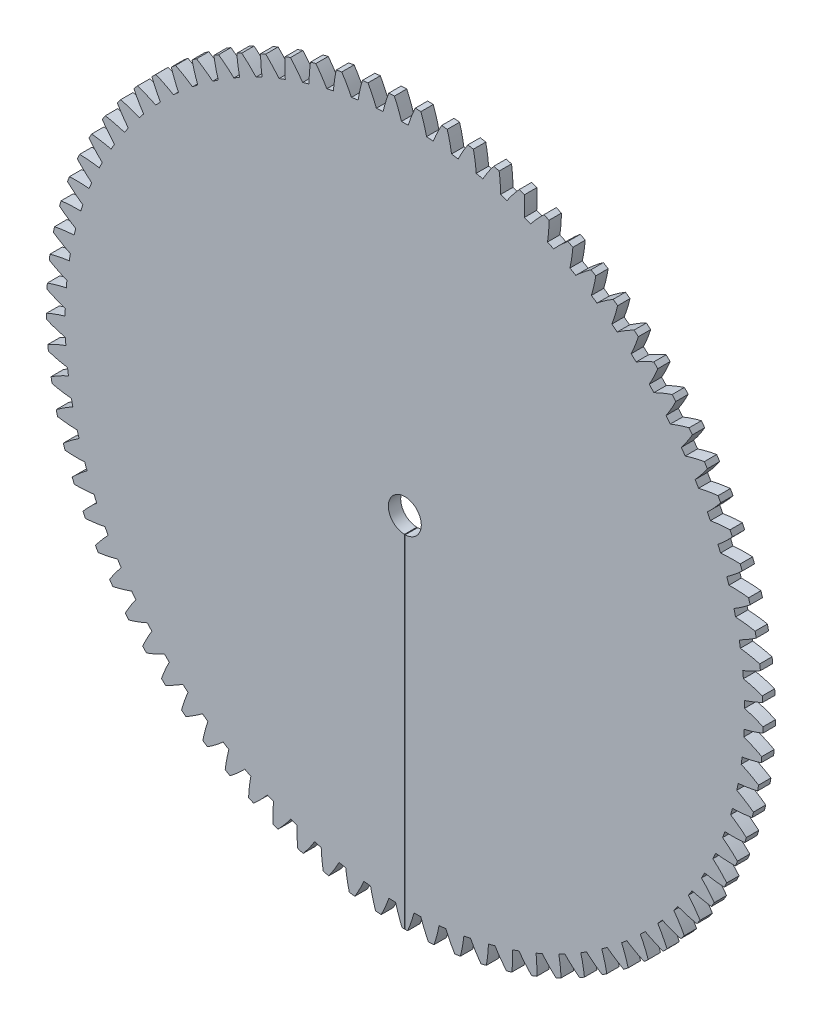
from build123d import *

# Parameters (mm, degrees)
RESSALTO_EXTRUS_O1_DEPTH = 3
CORTE_EXTRUS_O1_DEPTH    = 124.073148981
PADR_OCIRCULAR1_COUNT    = 85


with BuildPart() as part:
    # Esboço1 → Ressalto-extrusão1 (new body)
    with BuildSketch(Plane.XY):
        with BuildLine():
            Line((0.1, -3.998749805), (0.1, -86.999942529))
            ThreePointArc((0.1, -86.999942529), (0, 87), (-0.1, -86.999942529))
            Line((-0.1, -86.999942529), (-0.1, -3.998749805))
            ThreePointArc((-0.1, -3.998749805), (0, 4), (0.1, -3.998749805))
        make_face()
    extrude(amount=RESSALTO_EXTRUS_O1_DEPTH)

    # Esboço2 → Corte-extrusão1 (cut, through all)
    with BuildSketch(Plane.XY.offset(3)):
        with BuildLine():
            ThreePointArc((0.822690016, 82.494897916), (0, 82.499), (-0.822690016, 82.494897916))
            ThreePointArc((-0.822690016, 82.494897916), (-1.606030648, 84.772065195), (-2.548591338, 86.988073478))
            ThreePointArc((-2.548591338, 86.988073478), (0, 87.0254), (2.548591338, 86.988073478))
            ThreePointArc((2.548591338, 86.988073478), (1.606030648, 84.772065195), (0.822690016, 82.494897916))
        make_face()
    corte_extrus_o1 = extrude(amount=-CORTE_EXTRUS_O1_DEPTH, mode=Mode.SUBTRACT)

    # PadrãoCircular1: Corte-extrusão1 ×85 about axis
    padr_ocircular1_axis = Axis((0, 0, 0), (0, 0, 1))
    for i in range(1, PADR_OCIRCULAR1_COUNT):
        add(corte_extrus_o1.rotate(padr_ocircular1_axis, i * 360 / PADR_OCIRCULAR1_COUNT), mode=Mode.SUBTRACT)


solid = part.part
